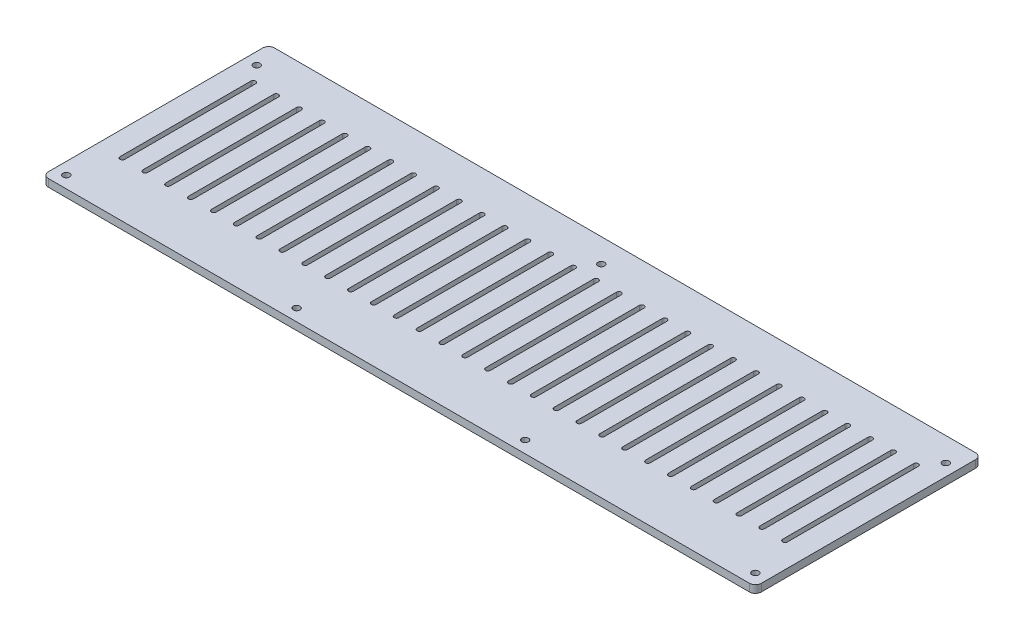
from build123d import *

# Parameters (mm, degrees)
SKETCH3_R           = 1.4
BOSS_EXTRUDE1_DEPTH = 3.175


with BuildPart() as part:
    # Sketch3 → Boss-Extrude1 (new body)
    with BuildSketch(Plane(origin=(0, 0, 0), x_dir=(1, 0, 0), z_dir=(0, 1, 0))):
        with BuildLine():
            Line((-147.25, 47.5), (147.25, 47.5))
            ThreePointArc((147.25, 47.5), (149.017766953, 46.767766953), (149.75, 45))
            Line((149.75, 45), (149.75, -45))
            ThreePointArc((149.75, -45), (149.017766953, -46.767766953), (147.25, -47.5))
            Line((147.25, -47.5), (-147.25, -47.5))
            ThreePointArc((-147.25, -47.5), (-149.017766953, -46.767766953), (-149.75, -45))
            Line((-149.75, -45), (-149.75, 45))
            ThreePointArc((-149.75, 45), (-149.017766953, 46.767766953), (-147.25, 47.5))
        make_face()
        with Locations(Location((-144.75, 37.5, 0), (0, 0, 270))):
            Circle(SKETCH3_R, mode=Mode.SUBTRACT)
        with Locations(Location((-144.75, -42.5, 0), (0, 0, 270))):
            Circle(SKETCH3_R, mode=Mode.SUBTRACT)
        with Locations(Location((144.75, -42.5, 0), (0, 0, 270))):
            Circle(SKETCH3_R, mode=Mode.SUBTRACT)
        with Locations(Location((144.75, 37.5, 0), (0, 0, 270))):
            Circle(SKETCH3_R, mode=Mode.SUBTRACT)
        with Locations(Location((-48, -42.5, 0), (0, 0, 270))):
            Circle(SKETCH3_R, mode=Mode.SUBTRACT)
        with Locations(Location((48, -42.5, 0), (0, 0, 270))):
            Circle(SKETCH3_R, mode=Mode.SUBTRACT)
        with Locations(Location((0, 37.5, 0), (0, 0, 270))):
            Circle(SKETCH3_R, mode=Mode.SUBTRACT)
        with BuildLine():
            Line((-138.2, 30.5), (-138.2, -24.5))
            ThreePointArc((-138.2, -24.5), (-139.2, -25.5), (-140.2, -24.5))
            Line((-140.2, -24.5), (-140.2, 30.5))
            ThreePointArc((-140.2, 30.5), (-139.2, 31.5), (-138.2, 30.5))
        make_face(mode=Mode.SUBTRACT)
        with BuildLine():
            Line((-128.6, 30.5), (-128.6, -24.5))
            ThreePointArc((-128.6, -24.5), (-129.6, -25.5), (-130.6, -24.5))
            Line((-130.6, -24.5), (-130.6, 30.5))
            ThreePointArc((-130.6, 30.5), (-129.6, 31.5), (-128.6, 30.5))
        make_face(mode=Mode.SUBTRACT)
        with BuildLine():
            Line((-119, 30.5), (-119, -24.5))
            ThreePointArc((-119, -24.5), (-120, -25.5), (-121, -24.5))
            Line((-121, -24.5), (-121, 30.5))
            ThreePointArc((-121, 30.5), (-120, 31.5), (-119, 30.5))
        make_face(mode=Mode.SUBTRACT)
        with BuildLine():
            Line((-109.4, 30.5), (-109.4, -24.5))
            ThreePointArc((-109.4, -24.5), (-110.4, -25.5), (-111.4, -24.5))
            Line((-111.4, -24.5), (-111.4, 30.5))
            ThreePointArc((-111.4, 30.5), (-110.4, 31.5), (-109.4, 30.5))
        make_face(mode=Mode.SUBTRACT)
        with BuildLine():
            Line((-99.8, 30.5), (-99.8, -24.5))
            ThreePointArc((-99.8, -24.5), (-100.8, -25.5), (-101.8, -24.5))
            Line((-101.8, -24.5), (-101.8, 30.5))
            ThreePointArc((-101.8, 30.5), (-100.8, 31.5), (-99.8, 30.5))
        make_face(mode=Mode.SUBTRACT)
        with BuildLine():
            Line((-90.2, 30.5), (-90.2, -24.5))
            ThreePointArc((-90.2, -24.5), (-91.2, -25.5), (-92.2, -24.5))
            Line((-92.2, -24.5), (-92.2, 30.5))
            ThreePointArc((-92.2, 30.5), (-91.2, 31.5), (-90.2, 30.5))
        make_face(mode=Mode.SUBTRACT)
        with BuildLine():
            Line((-80.6, 30.5), (-80.6, -24.5))
            ThreePointArc((-80.6, -24.5), (-81.6, -25.5), (-82.6, -24.5))
            Line((-82.6, -24.5), (-82.6, 30.5))
            ThreePointArc((-82.6, 30.5), (-81.6, 31.5), (-80.6, 30.5))
        make_face(mode=Mode.SUBTRACT)
        with BuildLine():
            Line((-71, 30.5), (-71, -24.5))
            ThreePointArc((-71, -24.5), (-72, -25.5), (-73, -24.5))
            Line((-73, -24.5), (-73, 30.5))
            ThreePointArc((-73, 30.5), (-72, 31.5), (-71, 30.5))
        make_face(mode=Mode.SUBTRACT)
        with BuildLine():
            Line((-61.4, 30.5), (-61.4, -24.5))
            ThreePointArc((-61.4, -24.5), (-62.4, -25.5), (-63.4, -24.5))
            Line((-63.4, -24.5), (-63.4, 30.5))
            ThreePointArc((-63.4, 30.5), (-62.4, 31.5), (-61.4, 30.5))
        make_face(mode=Mode.SUBTRACT)
        with BuildLine():
            Line((-51.8, 30.5), (-51.8, -24.5))
            ThreePointArc((-51.8, -24.5), (-52.8, -25.5), (-53.8, -24.5))
            Line((-53.8, -24.5), (-53.8, 30.5))
            ThreePointArc((-53.8, 30.5), (-52.8, 31.5), (-51.8, 30.5))
        make_face(mode=Mode.SUBTRACT)
        with BuildLine():
            Line((-42.2, 30.5), (-42.2, -24.5))
            ThreePointArc((-42.2, -24.5), (-43.2, -25.5), (-44.2, -24.5))
            Line((-44.2, -24.5), (-44.2, 30.5))
            ThreePointArc((-44.2, 30.5), (-43.2, 31.5), (-42.2, 30.5))
        make_face(mode=Mode.SUBTRACT)
        with BuildLine():
            Line((-32.6, 30.5), (-32.6, -24.5))
            ThreePointArc((-32.6, -24.5), (-33.6, -25.5), (-34.6, -24.5))
            Line((-34.6, -24.5), (-34.6, 30.5))
            ThreePointArc((-34.6, 30.5), (-33.6, 31.5), (-32.6, 30.5))
        make_face(mode=Mode.SUBTRACT)
        with BuildLine():
            Line((-23, 30.5), (-23, -24.5))
            ThreePointArc((-23, -24.5), (-24, -25.5), (-25, -24.5))
            Line((-25, -24.5), (-25, 30.5))
            ThreePointArc((-25, 30.5), (-24, 31.5), (-23, 30.5))
        make_face(mode=Mode.SUBTRACT)
        with BuildLine():
            Line((-13.4, 30.5), (-13.4, -24.5))
            ThreePointArc((-13.4, -24.5), (-14.4, -25.5), (-15.4, -24.5))
            Line((-15.4, -24.5), (-15.4, 30.5))
            ThreePointArc((-15.4, 30.5), (-14.4, 31.5), (-13.4, 30.5))
        make_face(mode=Mode.SUBTRACT)
        with BuildLine():
            Line((-3.8, 30.5), (-3.8, -24.5))
            ThreePointArc((-3.8, -24.5), (-4.8, -25.5), (-5.8, -24.5))
            Line((-5.8, -24.5), (-5.8, 30.5))
            ThreePointArc((-5.8, 30.5), (-4.8, 31.5), (-3.8, 30.5))
        make_face(mode=Mode.SUBTRACT)
        with BuildLine():
            Line((5.8, 30.5), (5.8, -24.5))
            ThreePointArc((5.8, -24.5), (4.8, -25.5), (3.8, -24.5))
            Line((3.8, -24.5), (3.8, 30.5))
            ThreePointArc((3.8, 30.5), (4.8, 31.5), (5.8, 30.5))
        make_face(mode=Mode.SUBTRACT)
        with BuildLine():
            Line((15.4, 30.5), (15.4, -24.5))
            ThreePointArc((15.4, -24.5), (14.4, -25.5), (13.4, -24.5))
            Line((13.4, -24.5), (13.4, 30.5))
            ThreePointArc((13.4, 30.5), (14.4, 31.5), (15.4, 30.5))
        make_face(mode=Mode.SUBTRACT)
        with BuildLine():
            Line((25, 30.5), (25, -24.5))
            ThreePointArc((25, -24.5), (24, -25.5), (23, -24.5))
            Line((23, -24.5), (23, 30.5))
            ThreePointArc((23, 30.5), (24, 31.5), (25, 30.5))
        make_face(mode=Mode.SUBTRACT)
        with BuildLine():
            Line((34.6, 30.5), (34.6, -24.5))
            ThreePointArc((34.6, -24.5), (33.6, -25.5), (32.6, -24.5))
            Line((32.6, -24.5), (32.6, 30.5))
            ThreePointArc((32.6, 30.5), (33.6, 31.5), (34.6, 30.5))
        make_face(mode=Mode.SUBTRACT)
        with BuildLine():
            Line((44.2, 30.5), (44.2, -24.5))
            ThreePointArc((44.2, -24.5), (43.2, -25.5), (42.2, -24.5))
            Line((42.2, -24.5), (42.2, 30.5))
            ThreePointArc((42.2, 30.5), (43.2, 31.5), (44.2, 30.5))
        make_face(mode=Mode.SUBTRACT)
        with BuildLine():
            Line((53.8, 30.5), (53.8, -24.5))
            ThreePointArc((53.8, -24.5), (52.8, -25.5), (51.8, -24.5))
            Line((51.8, -24.5), (51.8, 30.5))
            ThreePointArc((51.8, 30.5), (52.8, 31.5), (53.8, 30.5))
        make_face(mode=Mode.SUBTRACT)
        with BuildLine():
            Line((63.4, 30.5), (63.4, -24.5))
            ThreePointArc((63.4, -24.5), (62.4, -25.5), (61.4, -24.5))
            Line((61.4, -24.5), (61.4, 30.5))
            ThreePointArc((61.4, 30.5), (62.4, 31.5), (63.4, 30.5))
        make_face(mode=Mode.SUBTRACT)
        with BuildLine():
            Line((73, 30.5), (73, -24.5))
            ThreePointArc((73, -24.5), (72, -25.5), (71, -24.5))
            Line((71, -24.5), (71, 30.5))
            ThreePointArc((71, 30.5), (72, 31.5), (73, 30.5))
        make_face(mode=Mode.SUBTRACT)
        with BuildLine():
            Line((82.6, 30.5), (82.6, -24.5))
            ThreePointArc((82.6, -24.5), (81.6, -25.5), (80.6, -24.5))
            Line((80.6, -24.5), (80.6, 30.5))
            ThreePointArc((80.6, 30.5), (81.6, 31.5), (82.6, 30.5))
        make_face(mode=Mode.SUBTRACT)
        with BuildLine():
            Line((92.2, 30.5), (92.2, -24.5))
            ThreePointArc((92.2, -24.5), (91.2, -25.5), (90.2, -24.5))
            Line((90.2, -24.5), (90.2, 30.5))
            ThreePointArc((90.2, 30.5), (91.2, 31.5), (92.2, 30.5))
        make_face(mode=Mode.SUBTRACT)
        with BuildLine():
            Line((101.8, 30.5), (101.8, -24.5))
            ThreePointArc((101.8, -24.5), (100.8, -25.5), (99.8, -24.5))
            Line((99.8, -24.5), (99.8, 30.5))
            ThreePointArc((99.8, 30.5), (100.8, 31.5), (101.8, 30.5))
        make_face(mode=Mode.SUBTRACT)
        with BuildLine():
            Line((111.4, 30.5), (111.4, -24.5))
            ThreePointArc((111.4, -24.5), (110.4, -25.5), (109.4, -24.5))
            Line((109.4, -24.5), (109.4, 30.5))
            ThreePointArc((109.4, 30.5), (110.4, 31.5), (111.4, 30.5))
        make_face(mode=Mode.SUBTRACT)
        with BuildLine():
            Line((121, 30.5), (121, -24.5))
            ThreePointArc((121, -24.5), (120, -25.5), (119, -24.5))
            Line((119, -24.5), (119, 30.5))
            ThreePointArc((119, 30.5), (120, 31.5), (121, 30.5))
        make_face(mode=Mode.SUBTRACT)
        with BuildLine():
            Line((130.6, 30.5), (130.6, -24.5))
            ThreePointArc((130.6, -24.5), (129.6, -25.5), (128.6, -24.5))
            Line((128.6, -24.5), (128.6, 30.5))
            ThreePointArc((128.6, 30.5), (129.6, 31.5), (130.6, 30.5))
        make_face(mode=Mode.SUBTRACT)
        with BuildLine():
            Line((140.2, 30.5), (140.2, -24.5))
            ThreePointArc((140.2, -24.5), (139.2, -25.5), (138.2, -24.5))
            Line((138.2, -24.5), (138.2, 30.5))
            ThreePointArc((138.2, 30.5), (139.2, 31.5), (140.2, 30.5))
        make_face(mode=Mode.SUBTRACT)
    extrude(amount=BOSS_EXTRUDE1_DEPTH)


solid = part.part
